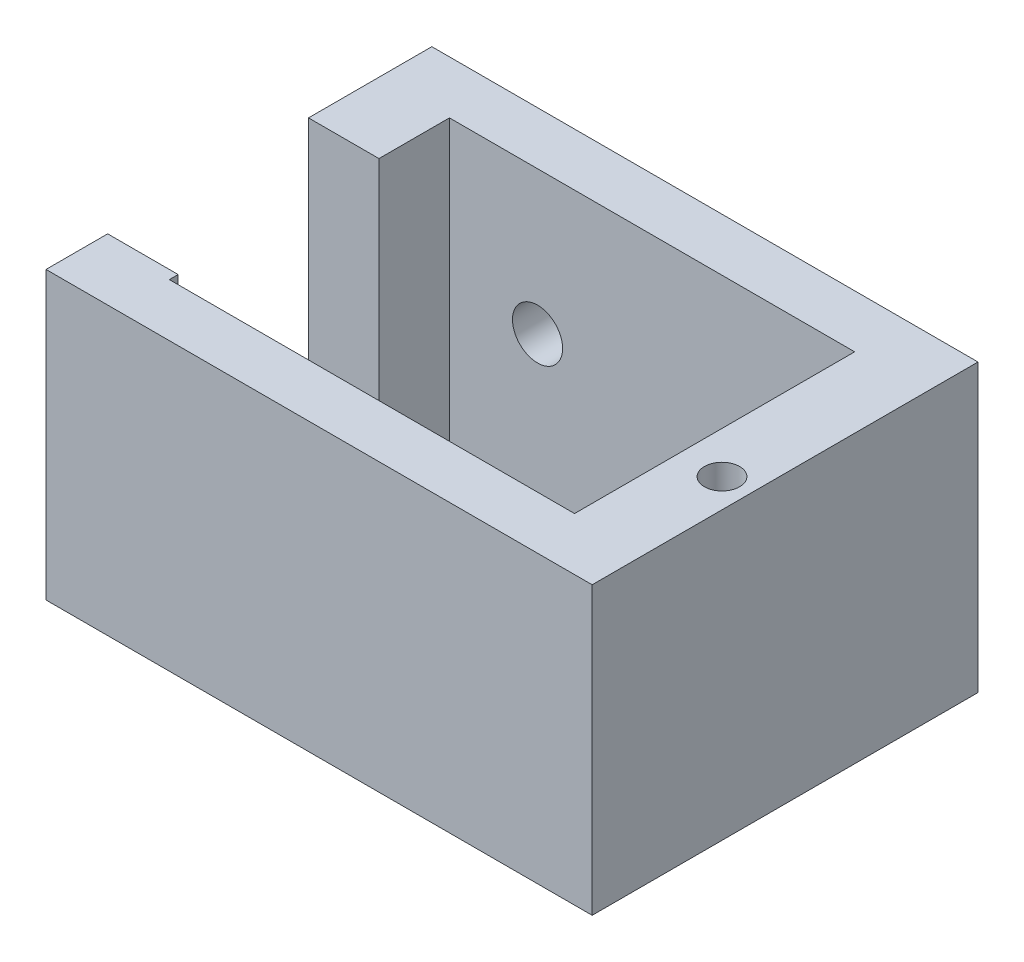
from build123d import *

# Parameters (mm, degrees)
SKETCH2_W           = 31
SKETCH2_H           = 21.9
BOSS_EXTRUDE1_DEPTH = 16.25
SKETCH3_W           = 23
SKETCH3_H           = 15.9
CUT_EXTRUDE1_DEPTH  = 25.984295067
SKETCH6_R           = 1.4224
CUT_EXTRUDE3_DEPTH  = 10
SKETCH7_W           = 11.4
SKETCH7_H           = 9.25
CUT_EXTRUDE4_DEPTH  = 10
SKETCH9_R           = 1
CUT_EXTRUDE5_DEPTH  = 10
SKETCH12_W          = 11.4
SKETCH12_H          = 3.5
CUT_EXTRUDE8_DEPTH  = 4


with BuildPart() as part:
    # Sketch2 → Boss-Extrude1 (new body)
    with BuildSketch(Plane(origin=(0, 0, 0), x_dir=(1, 0, 0), z_dir=(0, 1, 0))):
        Rectangle(SKETCH2_W, SKETCH2_H)
    extrude(amount=BOSS_EXTRUDE1_DEPTH)

    # Sketch3 → Cut-Extrude1 (cut, through all)
    with BuildSketch(Plane(origin=(0, 16.25, 0), x_dir=(1, 0, 0), z_dir=(0, 1, 0))):
        Rectangle(SKETCH3_W, SKETCH3_H)
    extrude(amount=-CUT_EXTRUDE1_DEPTH, mode=Mode.SUBTRACT)

    # Sketch6 → Cut-Extrude3 (cut)
    with BuildSketch(Plane(origin=(0, 0, -10.95), x_dir=(-1, 0, 0), z_dir=(0, 0, -1))):
        with Locations((-6.5, 8.125)):
            Circle(SKETCH6_R)
        with Locations((6.5, 8.125)):
            Circle(SKETCH6_R)
    extrude(amount=-CUT_EXTRUDE3_DEPTH, mode=Mode.SUBTRACT)

    # Sketch7 → Cut-Extrude4 (cut)
    with BuildSketch(Plane.ZY.offset(15.5)):
        with Locations((1.75, 8.125)):
            Rectangle(SKETCH7_W, SKETCH7_H)
    extrude(amount=-CUT_EXTRUDE4_DEPTH, mode=Mode.SUBTRACT)

    # Sketch9 → Cut-Extrude5 (cut)
    with BuildSketch(Plane(origin=(0, 16.25, 0), x_dir=(1, 0, 0), z_dir=(0, 1, 0))):
        with Locations(Location((-13.37, -1.95, 0), (0, 0, 270))):
            Circle(SKETCH9_R)
        with Locations(Location((13.87, -1.95, 0), (0, 0, 270))):
            Circle(SKETCH9_R)
    extrude(amount=-CUT_EXTRUDE5_DEPTH, mode=Mode.SUBTRACT)

    # Sketch12 → Cut-Extrude8 (cut)
    with BuildSketch(Plane.ZY.offset(15.5)):
        with Locations((1.75, 14.5)):
            Rectangle(SKETCH12_W, SKETCH12_H)
    extrude(amount=-CUT_EXTRUDE8_DEPTH, mode=Mode.SUBTRACT)


solid = part.part
